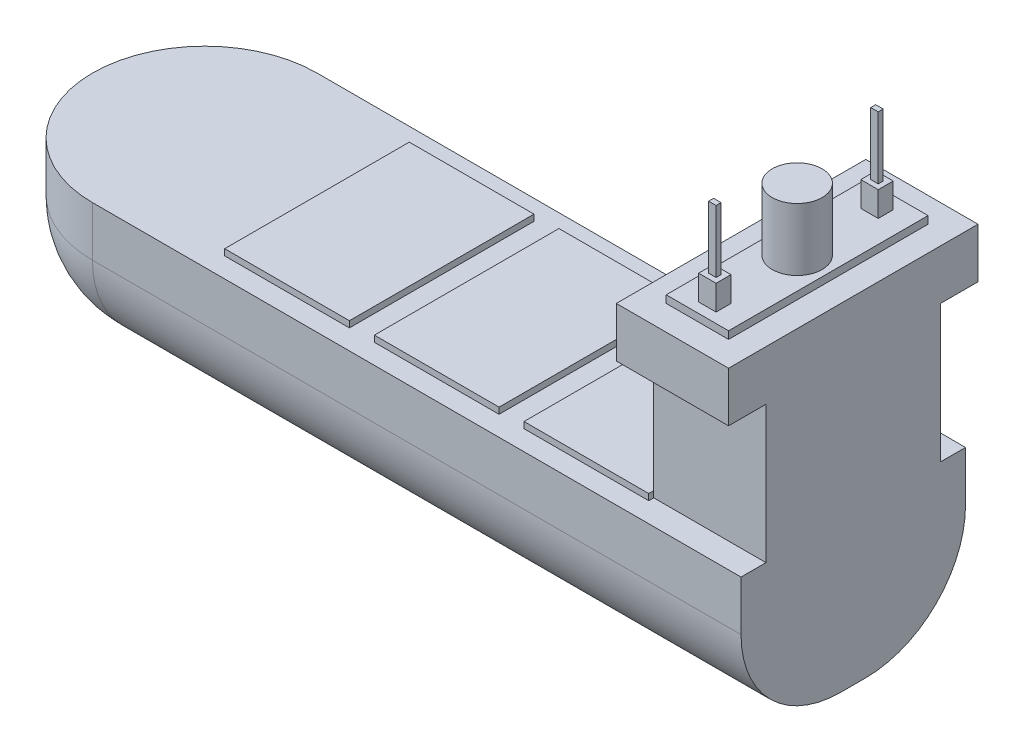
from build123d import *

# Parameters (mm, degrees)
SALIENTE_EXTRUIR1_DEPTH  = 60
REDONDEO2_R              = 40
CROQUIS3_W               = 45
CROQUIS3_H               = 70
SALIENTE_EXTRUIR2_DEPTH  = 75
CROQUIS6_W               = 45
CROQUIS6_H               = 20
SALIENTE_EXTRUIR5_DEPTH  = 15
CROQUIS7_W               = 45
CROQUIS7_H               = 20
SALIENTE_EXTRUIR6_DEPTH  = 15
CROQUIS8_W               = 50
CROQUIS8_H               = 74
SALIENTE_EXTRUIR7_DEPTH  = 2.5
CROQUIS9_W               = 25
CROQUIS9_H               = 80
SALIENTE_EXTRUIR8_DEPTH  = 3
CROQUIS10_W              = 7
CROQUIS10_H              = 6
SALIENTE_EXTRUIR9_DEPTH  = 10
CROQUIS12_W              = 3
CROQUIS12_H              = 2
SALIENTE_EXTRUIR10_DEPTH = 25
MATRIZL1_COUNT           = 2
MATRIZL1_PITCH           = 65
CROQUIS13_R              = 10
SALIENTE_EXTRUIR11_DEPTH = 25
ESCALA3_SCALE            = 2.5


with BuildPart() as part:
    # Croquis2 → Saliente-Extruir1 (new body)
    with BuildSketch(Plane(origin=(0, 0, 0), x_dir=(1, 0, 0), z_dir=(0, 1, 0))):
        with BuildLine():
            Line((130, -45), (-130, -45))
            ThreePointArc((-130, -45), (-175, 0), (-130, 45))
            Line((-130, 45), (130, 45))
            Line((130, 45), (130, -45))
        make_face()
    extrude(amount=SALIENTE_EXTRUIR1_DEPTH)

    # Redondeo2
    redondeo2_edges = [part.edges().sort_by_distance(p)[0] for p in [
        (0, 0, -45),
        (0, 0, 45),
        (-175, 0, 0),
    ]]
    fillet(redondeo2_edges, radius=REDONDEO2_R)

    # Croquis3 → Saliente-Extruir2 (add)
    with BuildSketch(Plane(origin=(0, 60, 0), x_dir=(1, 0, 0), z_dir=(0, 1, 0))):
        with Locations((107.5, 0)):
            Rectangle(CROQUIS3_W, CROQUIS3_H)
    extrude(amount=SALIENTE_EXTRUIR2_DEPTH)

    # Croquis6 → Saliente-Extruir5 (add)
    with BuildSketch(Plane(origin=(0, 0, -35), x_dir=(-1, 0, 0), z_dir=(0, 0, -1))):
        with Locations((-107.5, 125)):
            Rectangle(CROQUIS6_W, CROQUIS6_H)
    extrude(amount=SALIENTE_EXTRUIR5_DEPTH)

    # Croquis7 → Saliente-Extruir6 (add)
    with BuildSketch(Plane.XY.offset(35)):
        with Locations((107.5, 125)):
            Rectangle(CROQUIS7_W, CROQUIS7_H)
    extrude(amount=SALIENTE_EXTRUIR6_DEPTH)

    # Croquis8 → Saliente-Extruir7 (add)
    with BuildSketch(Plane(origin=(0, 60, 0), x_dir=(1, 0, 0), z_dir=(0, 1, 0))):
        Rectangle(CROQUIS8_W, CROQUIS8_H)
        with Locations((-60, 0)):
            Rectangle(CROQUIS8_W, CROQUIS8_H)
        with Locations((60, 0)):
            Rectangle(CROQUIS8_W, CROQUIS8_H)
    extrude(amount=SALIENTE_EXTRUIR7_DEPTH)

    # Croquis9 → Saliente-Extruir8 (add)
    with BuildSketch(Plane(origin=(0, 135, 0), x_dir=(1, 0, 0), z_dir=(0, 1, 0))):
        with Locations((107.5, 0)):
            Rectangle(CROQUIS9_W, CROQUIS9_H)
    extrude(amount=SALIENTE_EXTRUIR8_DEPTH)

    # Croquis10 → Saliente-Extruir9 (add)
    with BuildSketch(Plane(origin=(0, 138, 0), x_dir=(1, 0, 0), z_dir=(0, 1, 0))):
        with Locations((107.5, -33)):
            Rectangle(CROQUIS10_W, CROQUIS10_H)
    saliente_extruir9 = extrude(amount=SALIENTE_EXTRUIR9_DEPTH)

    # Croquis12 → Saliente-Extruir10 (add)
    with BuildSketch(Plane(origin=(0, 148, 0), x_dir=(1, 0, 0), z_dir=(0, 1, 0))):
        with Locations((107.5, -33)):
            Rectangle(CROQUIS12_W, CROQUIS12_H)
    saliente_extruir10 = extrude(amount=SALIENTE_EXTRUIR10_DEPTH)

    # MatrizL1: Saliente-Extruir9, Saliente-Extruir10 ×2
    with Locations(*[(0, 0, -i * MATRIZL1_PITCH) for i in range(1, MATRIZL1_COUNT)]):
        add(saliente_extruir9)
        add(saliente_extruir10)

    # Croquis13 → Saliente-Extruir11 (add)
    with BuildSketch(Plane(origin=(0, 138, 0), x_dir=(1, 0, 0), z_dir=(0, 1, 0))):
        with Locations(Location((107.5, 0, 0), (0, 0, 270))):
            Circle(CROQUIS13_R)
    extrude(amount=SALIENTE_EXTRUIR11_DEPTH)


with BuildPart() as part_1:
    # Escala3: scaled about (4.422531692, 45.233244439, 0.000338602)
    add(part.part.scale(ESCALA3_SCALE).moved(Location((-6.633797538, -67.849866659, -0.000507903))))


solid = part_1.part
